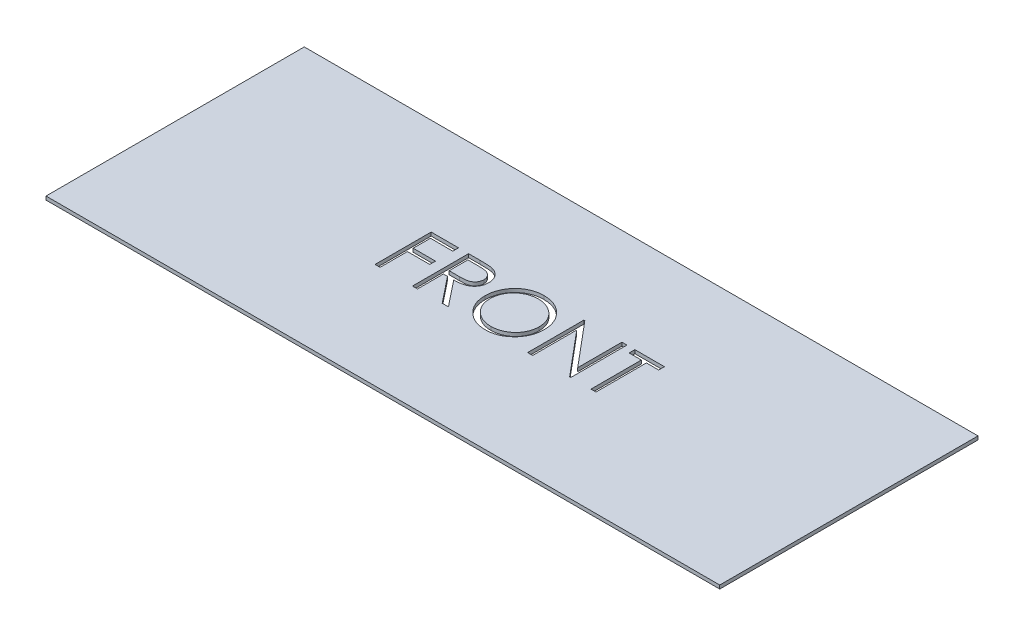
from build123d import *

# Parameters (mm, degrees)
SKETCH1_W           = 38.1
SKETCH1_H           = 14.605
BOSS_EXTRUDE1_DEPTH = 0.2
CUT_EXTRUDE1_DEPTH  = 0.2


with BuildPart() as part:
    # Sketch1 → Boss-Extrude1 (new body)
    with BuildSketch(Plane(origin=(0, 0, 0), x_dir=(1, 0, 0), z_dir=(0, 1, 0))):
        Rectangle(SKETCH1_W, SKETCH1_H)
    extrude(amount=BOSS_EXTRUDE1_DEPTH)

    # Sketch2 → Cut-Extrude1 (cut)
    # profile 1 of 5: a face of its own
    with BuildSketch(Plane(origin=(0, 0.2, 0), x_dir=(1, 0, 0), z_dir=(0, 1, 0))):
        Polygon((-6.395833275, 1.824678693), (-4.849038403, 1.824678693), (-4.849038403, 1.499037668), (-6.110897378, 1.499037668), (-6.110897378, 0.522114591), (-4.849038403, 0.522114591), (-4.849038403, 0.196473565), (-6.110897378, 0.196473565), (-6.110897378, -1.350321307), (-6.395833275, -1.350321307), align=None)
    # profile 2 of 5: a face of its own
    with BuildSketch(Plane(origin=(0, 0.2, 0), x_dir=(1, 0, 0), z_dir=(0, 1, 0))):
        with BuildLine():
            Line((-4.279166608, 1.824678693), (-3.643784998, 1.824678693))
            add(Edge.make_bspline(
                [(-3.643784998, 1.824678693), (-3.601384117, 1.824537555), (-3.519969729, 1.824266553), (-3.403335405, 1.822755468), (-3.297356538, 1.818424445), (-3.202088541, 1.814697373), (-3.117533161, 1.807901112), (-3.043431119, 1.801405382), (-2.980123708, 1.792902133), (-2.941800686, 1.78500507), (-2.92444906, 1.781429495)],
                knots=[0, 0, 0, 0, 1.410062039, 2.707475311, 3.878576406, 4.937260626, 5.877586885, 6.699081471, 7.410979367, 8, 8, 8, 8], degree=3))
            add(Edge.make_bspline(
                [(-2.92444906, 1.781429495), (-2.901220194, 1.775690215), (-2.855257997, 1.764334089), (-2.789081865, 1.740331451), (-2.726022443, 1.712555077), (-2.666341674, 1.679930845), (-2.610338492, 1.642216581), (-2.557435452, 1.600063356), (-2.507392496, 1.553701819), (-2.462233446, 1.50196307), (-2.419653021, 1.447682808), (-2.383740481, 1.388987257), (-2.352782889, 1.327608585), (-2.328135348, 1.262922571), (-2.308288901, 1.195556535), (-2.294295098, 1.124900269), (-2.285902949, 1.05127567), (-2.285048552, 1.001058139), (-2.284615326, 0.97559516)],
                knots=[0, 0, 0, 0, 1.027469482, 2.033020251, 3.019912614, 3.986113645, 4.951240523, 5.91722682, 6.890402269, 7.87763091, 8.8651537, 9.85103654, 10.82876324, 11.815024772, 12.821070561, 13.842952187, 14.906261191, 16, 16, 16, 16], degree=3))
            add(Edge.make_bspline(
                [(-2.284615326, 0.97559516), (-2.285947917, 0.933290458), (-2.288548148, 0.850743027), (-2.312791635, 0.730944942), (-2.352503192, 0.619194635), (-2.407225033, 0.515632813), (-2.476911271, 0.422278156), (-2.560663046, 0.3402811), (-2.65852708, 0.271664894), (-2.749630816, 0.224082707), (-2.830107269, 0.19360914), (-2.896358917, 0.172167586), (-2.968628246, 0.155601374), (-3.046222828, 0.140760398), (-3.129465573, 0.129555646), (-3.218156966, 0.121349093), (-3.312360261, 0.116220063), (-3.377074988, 0.115456244), (-3.410366528, 0.115063309)],
                knots=[0, 0, 0, 0, 1.260483769, 2.459530307, 3.627416485, 4.787058657, 5.939039949, 7.08810263, 8.267026773, 9.491475466, 10.141966685, 10.831826277, 11.566392101, 12.351337768, 13.187381173, 14.07005841, 15.007169909, 16, 16, 16, 16], degree=3))
            Line((-3.410366528, 0.115063309), (-2.243910198, -1.350321307))
            Line((-2.243910198, -1.350321307), (-2.596263964, -1.350321307))
            Line((-2.596263964, -1.350321307), (-3.762720294, 0.115063309))
            Line((-3.762720294, 0.115063309), (-3.994230711, 0.115063309))
            Line((-3.994230711, 0.115063309), (-3.994230711, -1.350321307))
            Line((-3.994230711, -1.350321307), (-4.279166608, -1.350321307))
            Line((-4.279166608, -1.350321307), (-4.279166608, 1.824678693))
        make_face()
        with BuildLine():
            Line((-3.994230711, 1.499037668), (-3.994230711, 0.440704334))
            Line((-3.994230711, 0.440704334), (-3.412910599, 0.436252211))
            add(Edge.make_bspline(
                [(-3.412910599, 0.436252211), (-3.385768849, 0.436240204), (-3.333160408, 0.43621693), (-3.257050519, 0.439839855), (-3.186184418, 0.443961294), (-3.120833164, 0.450265343), (-3.060967564, 0.458389779), (-3.006617539, 0.468552487), (-2.95769437, 0.480392572), (-2.900636411, 0.498718333), (-2.836921843, 0.527752363), (-2.767678304, 0.569993923), (-2.708711898, 0.623124481), (-2.658893551, 0.683878973), (-2.618861853, 0.75067757), (-2.590638775, 0.822719563), (-2.572729559, 0.898186226), (-2.570617236, 0.950054939), (-2.569551224, 0.976231177)],
                knots=[0, 0, 0, 0, 1.146690395, 2.22261258, 3.21895312, 4.145990853, 4.996080663, 5.770904154, 6.481378293, 7.121626537, 8.300444488, 9.431385265, 10.535395872, 11.636531494, 12.74115979, 13.810798291, 14.895190096, 16, 16, 16, 16], degree=3))
            add(Edge.make_bspline(
                [(-2.569551224, 0.976231177), (-2.570641719, 1.001764141), (-2.572802684, 1.052361157), (-2.590445495, 1.126434733), (-2.620280862, 1.196345466), (-2.660487464, 1.261808963), (-2.709472412, 1.321232024), (-2.766910713, 1.372074798), (-2.831231855, 1.41402967), (-2.891349299, 1.440839715), (-2.945083192, 1.457277011), (-2.99173724, 1.468844138), (-3.044452652, 1.478137335), (-3.10348539, 1.485583218), (-3.16858344, 1.491983061), (-3.24007596, 1.496293603), (-3.31748861, 1.498846179), (-3.371143326, 1.498972353), (-3.398918211, 1.499037668)],
                knots=[0, 0, 0, 0, 1.101028733, 2.181837193, 3.264309656, 4.369019818, 5.486613113, 6.575447106, 7.666700264, 8.788928104, 9.402425223, 10.0903467, 10.862060571, 11.710948788, 12.657782767, 13.684531032, 14.801375019, 16, 16, 16, 16], degree=3))
            Line((-3.398918211, 1.499037668), (-3.994230711, 1.499037668))
        make_face(mode=Mode.SUBTRACT)
    # profile 3 of 5: a face of its own
    with BuildSketch(Plane(origin=(0, 0.2, 0), x_dir=(1, 0, 0), z_dir=(0, 1, 0))):
        with BuildLine():
            add(Edge.make_bspline(
                [(-0.106890967, 1.90608895), (-0.048100757, 1.904599894), (0.067368067, 1.901675264), (0.237071724, 1.879287792), (0.399082989, 1.840556974), (0.554721615, 1.788974125), (0.702125958, 1.720163361), (0.842405525, 1.636991834), (0.975226546, 1.538588189), (1.098798799, 1.425713105), (1.211880461, 1.302900972), (1.311508229, 1.171838868), (1.395003739, 1.03331924), (1.463570846, 0.887758343), (1.517363156, 0.735485372), (1.554482574, 0.575688527), (1.57819361, 0.409403172), (1.580965637, 0.295985945), (1.582371853, 0.238450729)],
                knots=[0, 0, 0, 0, 1.065120563, 2.091984664, 3.0946048, 4.079830382, 5.057816894, 6.036188127, 7.030412546, 8.04752943, 9.064399622, 10.05169764, 11.02544977, 11.989514704, 12.962713494, 13.945757189, 14.957906945, 16, 16, 16, 16], degree=3))
            add(Edge.make_bspline(
                [(1.582371853, 0.238450729), (1.580965843, 0.181339331), (1.578194434, 0.06876615), (1.554455614, -0.096463975), (1.517225564, -0.255296249), (1.46407038, -0.40746552), (1.395830125, -0.55313231), (1.311778648, -0.691913333), (1.212771978, -0.823854085), (1.10009862, -0.947509145), (0.977270532, -1.060899708), (0.845525933, -1.159704688), (0.707827707, -1.244725858), (0.5624039, -1.312565334), (0.411183153, -1.366787005), (0.252812045, -1.403755462), (0.088032671, -1.427601565), (-0.024336025, -1.430339791), (-0.081450262, -1.431731563)],
                knots=[0, 0, 0, 0, 1.043624062, 2.057103931, 3.04512605, 4.022047818, 4.998200453, 5.980619268, 6.982898556, 8.009068085, 9.034988726, 10.034168286, 11.015286542, 11.987931943, 12.962482838, 13.94673481, 14.956375938, 16, 16, 16, 16], degree=3))
            add(Edge.make_bspline(
                [(-0.081450262, -1.431731563), (-0.13898518, -1.430326048), (-0.252401819, -1.427555403), (-0.41889613, -1.403805129), (-0.578805226, -1.366665517), (-0.731671816, -1.3135891), (-0.877581145, -1.24499347), (-1.016818577, -1.161350926), (-1.148825232, -1.062103019), (-1.272506673, -0.949466198), (-1.385672017, -0.82684629), (-1.484332308, -0.69546093), (-1.567993661, -0.557887766), (-1.63635897, -0.413745012), (-1.690483158, -0.263729489), (-1.727408243, -0.106840513), (-1.751298714, 0.056027468), (-1.754051753, 0.16691924), (-1.75544866, 0.223186306)],
                knots=[0, 0, 0, 0, 1.053102029, 2.075944431, 3.073151272, 4.055350789, 5.033113405, 6.020478099, 7.024410459, 8.052272461, 9.079885166, 10.07527673, 11.055994387, 12.023226415, 12.992069828, 13.970394897, 14.97016774, 16, 16, 16, 16], degree=3))
            add(Edge.make_bspline(
                [(-1.75544866, 0.223186306), (-1.754963669, 0.260953084), (-1.753999806, 0.336010196), (-1.742395913, 0.447467755), (-1.725557799, 0.557132851), (-1.701426064, 0.66469364), (-1.669865051, 0.769886819), (-1.632624998, 0.873437868), (-1.587140995, 0.974297389), (-1.53572355, 1.07294318), (-1.478336053, 1.167837495), (-1.414948766, 1.257535402), (-1.34778811, 1.342789592), (-1.274161318, 1.421390803), (-1.196494971, 1.49562562), (-1.113529157, 1.564353227), (-1.025770121, 1.628193361), (-0.932840247, 1.685724671), (-0.837029384, 1.7377576), (-0.738262593, 1.78240885), (-0.637881274, 1.820732063), (-0.535415272, 1.851793383), (-0.431136686, 1.876315302), (-0.324817924, 1.893013401), (-0.216543688, 1.90464689), (-0.143599134, 1.905606195), (-0.106890967, 1.90608895)],
                knots=[0, 0, 0, 0, 1.037015668, 2.060948919, 3.074880161, 4.083647147, 5.086022904, 6.090072063, 7.104153813, 8.122640571, 9.144368836, 10.147691507, 11.138137339, 12.123020368, 13.103399296, 14.087645067, 15.080126199, 16.082011238, 17.087798457, 18.072939717, 19.057185487, 20.037253025, 21.01195951, 21.997135196, 22.992090687, 24, 24, 24, 24], degree=3))
        make_face()
        with BuildLine():
            add(Edge.make_bspline(
                [(-0.09289858, 1.580447924), (-0.123028997, 1.580080631), (-0.183001783, 1.579349556), (-0.272159898, 1.569719585), (-0.360145438, 1.555994614), (-0.446976574, 1.536417092), (-0.532289994, 1.509743416), (-0.616880921, 1.479044877), (-0.699977977, 1.441651459), (-0.781306834, 1.399403363), (-0.860151223, 1.352641128), (-0.93454846, 1.300959597), (-1.004691144, 1.245570765), (-1.070407536, 1.18634537), (-1.131504671, 1.122981803), (-1.189185078, 1.056440664), (-1.24113677, 0.98482002), (-1.288748686, 0.910062008), (-1.331355227, 0.832264002), (-1.36924237, 0.752245056), (-1.400234007, 0.66935244), (-1.425509163, 0.584485454), (-1.446463991, 0.497778509), (-1.459739051, 0.408573846), (-1.469474834, 0.317319708), (-1.470164122, 0.255650455), (-1.470512762, 0.224458341)],
                knots=[0, 0, 0, 0, 1.008559885, 2.007477868, 2.99961109, 3.989939068, 4.984837346, 5.991145699, 7.001802488, 8.033829008, 9.059044045, 10.069351652, 11.065060232, 12.050310815, 13.029377138, 14.011219647, 14.996725999, 15.989392538, 16.977580475, 17.965360261, 18.951710183, 19.937753436, 20.929683414, 21.935841486, 22.955955122, 24, 24, 24, 24], degree=3))
            add(Edge.make_bspline(
                [(-1.470512762, 0.224458341), (-1.46935628, 0.178591183), (-1.467081123, 0.088356295), (-1.44716247, -0.043876235), (-1.416481107, -0.170956324), (-1.371253353, -0.292188627), (-1.314692439, -0.408615226), (-1.244818045, -0.519203293), (-1.162033018, -0.623982715), (-1.06799539, -0.722221994), (-0.965195506, -0.81188926), (-0.85603653, -0.890596066), (-0.7416879, -0.95718965), (-0.621851423, -1.011441394), (-0.49716687, -1.054430656), (-0.366830806, -1.083893414), (-0.23171146, -1.103284006), (-0.139608652, -1.105146149), (-0.09289858, -1.106090537)],
                knots=[0, 0, 0, 0, 1.032063989, 2.030389145, 3.003944642, 3.970395727, 4.937377036, 5.913328081, 6.909231446, 7.93887556, 8.970685674, 9.976071282, 10.964166581, 11.944589148, 12.933237628, 13.927779006, 14.949070134, 16, 16, 16, 16], degree=3))
            add(Edge.make_bspline(
                [(-0.09289858, -1.106090537), (-0.061502817, -1.105659187), (0.000764408, -1.10480369), (0.093379632, -1.096187033), (0.184326339, -1.082369551), (0.273476964, -1.062475314), (0.360730329, -1.037576776), (0.446450614, -1.007996909), (0.529724778, -0.971093245), (0.611603345, -0.930319032), (0.689977078, -0.883836889), (0.764794168, -0.833909425), (0.834168807, -0.778602176), (0.899836036, -0.720256732), (0.961184011, -0.65769667), (1.017797876, -0.591003326), (1.069486995, -0.51975573), (1.117080832, -0.445111112), (1.159538078, -0.367100225), (1.196530546, -0.28679116), (1.227914165, -0.204381668), (1.253249309, -0.119752886), (1.273102549, -0.033065544), (1.286782191, 0.055796427), (1.296351132, 0.146655259), (1.29707238, 0.208108614), (1.297435956, 0.239086746)],
                knots=[0, 0, 0, 0, 1.047197238, 2.076906641, 3.100256066, 4.114471768, 5.12198147, 6.126382909, 7.136867548, 8.15857795, 9.17633901, 10.174870724, 11.156907918, 12.133735059, 13.104061851, 14.077631395, 15.04955518, 16.038496417, 17.029181396, 18.010275684, 18.986308667, 19.968651475, 20.955262928, 21.950658345, 22.966943676, 24, 24, 24, 24], degree=3))
            add(Edge.make_bspline(
                [(1.297435956, 0.239086746), (1.297072089, 0.269852954), (1.296350292, 0.330883394), (1.286786762, 0.421108565), (1.273088097, 0.509331121), (1.253346212, 0.595204713), (1.227900715, 0.678751233), (1.196525065, 0.759892211), (1.159526972, 0.838929931), (1.117065226, 0.915669043), (1.069335157, 0.989306127), (1.017179665, 1.059702601), (0.959698242, 1.125536445), (0.898533205, 1.188432917), (0.832156759, 1.247050574), (0.760869578, 1.301408861), (0.685537099, 1.352819617), (0.605774536, 1.399197805), (0.523456806, 1.442027859), (0.438989144, 1.478722698), (0.353328461, 1.50990312), (0.266692588, 1.536497796), (0.178352315, 1.555917937), (0.088904556, 1.569731954), (-0.001526936, 1.579346204), (-0.062344714, 1.580079519), (-0.09289858, 1.580447924)],
                knots=[0, 0, 0, 0, 1.02996197, 2.043119294, 3.035359645, 4.018872909, 4.991431989, 5.957985074, 6.929999688, 7.912076566, 8.892894881, 9.867085534, 10.843653904, 11.817741046, 12.803660682, 13.806313499, 14.818574707, 15.856120519, 16.894564902, 17.924820532, 18.937903209, 19.946497019, 20.957711757, 21.963978472, 22.977135795, 24, 24, 24, 24], degree=3))
        make_face(mode=Mode.SUBTRACT)
    # profile 4 of 5: a face of its own
    with BuildSketch(Plane(origin=(0, 0.2, 0), x_dir=(1, 0, 0), z_dir=(0, 1, 0))):
        Polygon((2.233653904, -1.350321307), (2.233653904, 1.824678693), (2.293439561, 1.824678693), (4.391025699, -0.674234568), (4.391025699, 1.824678693), (4.675961597, 1.824678693), (4.675961597, -1.350321307), (4.611087799, -1.350321307), (2.518589802, 1.142867796), (2.518589802, -1.350321307), align=None)
    # profile 5 of 5: a face of its own
    with BuildSketch(Plane(origin=(0, 0.2, 0), x_dir=(1, 0, 0), z_dir=(0, 1, 0))):
        Polygon((5.123718007, 1.499037668), (5.123718007, 1.824678693), (6.792628263, 1.824678693), (6.792628263, 1.499037668), (6.100641084, 1.499037668), (6.100641084, -1.350321307), (5.815705186, -1.350321307), (5.815705186, 1.499037668), align=None)
    extrude(amount=-CUT_EXTRUDE1_DEPTH, mode=Mode.SUBTRACT)


with BuildPart() as cut_extrude1_piece_1:
    # of the separate pieces the step leaves, piece 1, a body of its own (cut_extrude1_pieces)
    add(part.part.solids().sort_by_distance((-19.05, 0, 7.3025))[0])


with BuildPart() as cut_extrude1_piece_2:
    # of the separate pieces the step leaves, piece 2, a body of its own (cut_extrude1_pieces)
    add(part.part.solids().sort_by_distance((1.297435956, 0, -0.239086746))[0])


with BuildPart() as cut_extrude1_piece_3:
    # of the separate pieces the step leaves, piece 3, a body of its own (cut_extrude1_pieces)
    add(part.part.solids().sort_by_distance((-3.398918211, 0, -1.499037668))[0])


solid = Compound([cut_extrude1_piece_1.part, cut_extrude1_piece_2.part, cut_extrude1_piece_3.part])
